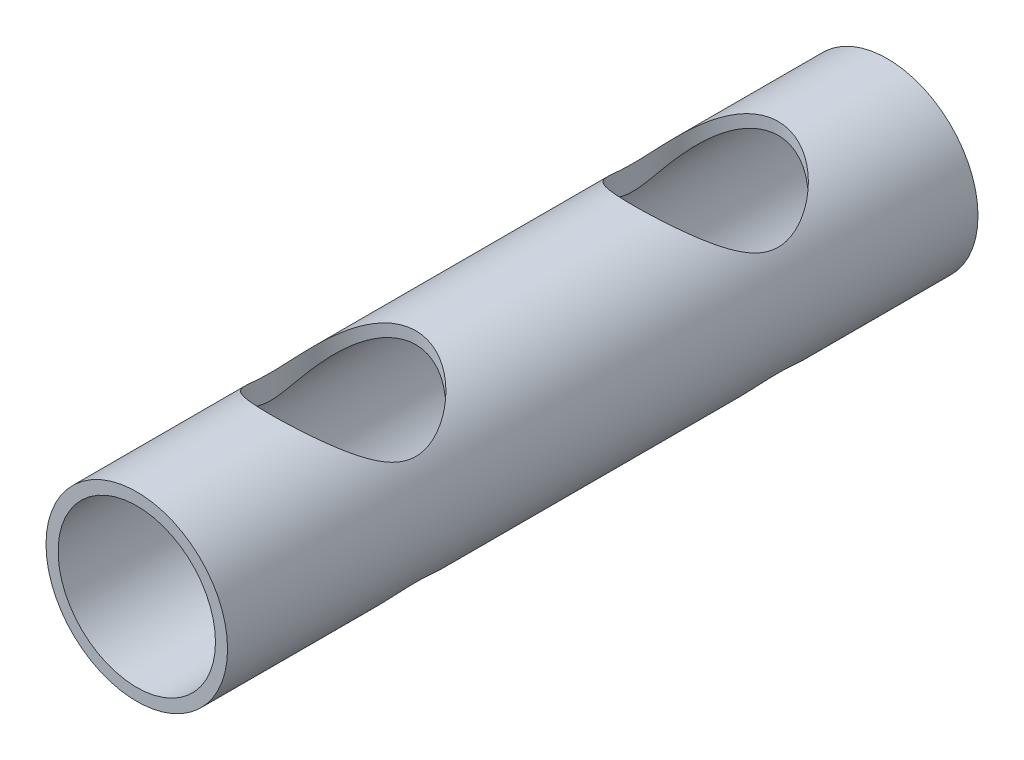
from build123d import *

# Parameters (mm, degrees)
SKETCH1_R           = 7.5
BOSS_EXTRUDE1_DEPTH = 62
SKETCH2_R           = 6.5
CUT_EXTRUDE1_DEPTH  = 63.900715417
SKETCH3_R           = 6
CUT_EXTRUDE2_DEPTH  = 65.228109111


with BuildPart() as part:
    # Sketch1 → Boss-Extrude1 (new body)
    with BuildSketch(Plane.XY):
        Circle(SKETCH1_R)
    extrude(amount=BOSS_EXTRUDE1_DEPTH)

    # Sketch2 → Cut-Extrude1 (cut, through all)
    with BuildSketch(Plane.XY.offset(62)):
        Circle(SKETCH2_R)
    extrude(amount=-CUT_EXTRUDE1_DEPTH, mode=Mode.SUBTRACT)

    # Sketch3 → Cut-Extrude2 (cut, through all)
    with BuildSketch(Plane(origin=(0, 7.5, 0), x_dir=(1, 0, 0), z_dir=(0, 1, 0))):
        with Locations(Location((0, -15, 0), (0, 0, 270))):
            Circle(SKETCH3_R)
        with Locations(Location((0, -44.945445828, 0), (0, 0, 270))):
            Circle(SKETCH3_R)
    extrude(amount=-CUT_EXTRUDE2_DEPTH, mode=Mode.SUBTRACT)


solid = part.part
